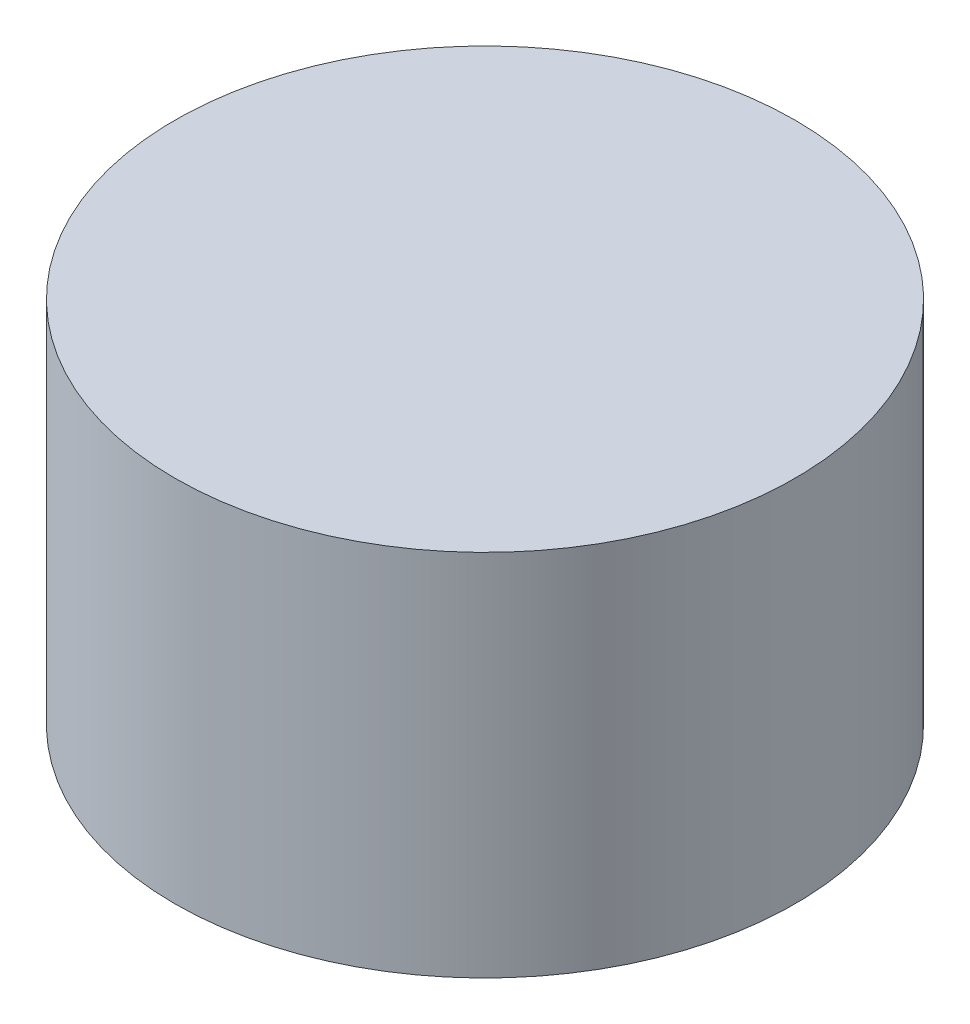
from build123d import *

# Parameters (mm, degrees)
SKETCH1_R           = 11.1125
BOSS_EXTRUDE1_DEPTH = 6.604
SKETCH2_R           = 9.906
BOSS_EXTRUDE2_DEPTH = 6.35
SKETCH3_R           = 9.906
SKETCH3_R_2         = 9.525
CUT_EXTRUDE1_DEPTH  = 6.096
SKETCH5_R           = 3.175
SKETCH6_R           = 6.604
CUT_EXTRUDE3_DEPTH  = 21.366183454


with BuildPart() as part:
    # Sketch1 → Boss-Extrude1 (new, symmetric)
    with BuildSketch(Plane(origin=(0, 0, 0), x_dir=(1, 0, 0), z_dir=(0, 1, 0))):
        with Locations(Location((0, 0, 0), (0, 0, 90))):
            Circle(SKETCH1_R)
    extrude(amount=BOSS_EXTRUDE1_DEPTH, both=True)


with BuildPart() as body_2:
    # Sketch2 → Boss-Extrude2 (new, symmetric)
    with BuildSketch(Plane(origin=(0, 0, 0), x_dir=(1, 0, 0), z_dir=(0, 1, 0))):
        with Locations(Location((0, 0, 0), (0, 0, 270))):
            Circle(SKETCH2_R)
    extrude(amount=BOSS_EXTRUDE2_DEPTH, both=True)

    # Sketch3 → Cut-Extrude1 (cut)
    with BuildSketch(Plane(origin=(0, 6.35, 0), x_dir=(1, 0, 0), z_dir=(0, 1, 0))):
        with Locations(Location((0, 0, 0), (0, 0, 270))):
            Circle(SKETCH3_R)
        with Locations(Location((0, 0, 0), (0, 0, 270))):
            Circle(SKETCH3_R_2, mode=Mode.SUBTRACT)
    extrude(amount=-CUT_EXTRUDE1_DEPTH, mode=Mode.SUBTRACT)

    # Sketch5 → Cut-Revolve1 (revolve, cut)
    with BuildSketch(Plane.XY, mode=Mode.PRIVATE) as cut_revolve1_sk:
        with Locations((-12.345590334, -3.048)):
            Circle(SKETCH5_R)
    revolve(cut_revolve1_sk.sketch.rotate(Axis((0, 0.254, 0), (0, -1, 0)), 270), axis=Axis((0, 0.254, 0), (0, -1, 0)), mode=Mode.SUBTRACT)

    # Sketch6 → Cut-Extrude3 (cut, through all)
    with BuildSketch(Plane.XZ.offset(6.35)):
        with Locations(Location((0, 0, 0), (0, 0, 270))):
            Circle(SKETCH6_R)
    extrude(amount=-CUT_EXTRUDE3_DEPTH, mode=Mode.SUBTRACT)


solid = Compound([part.part, body_2.part])
